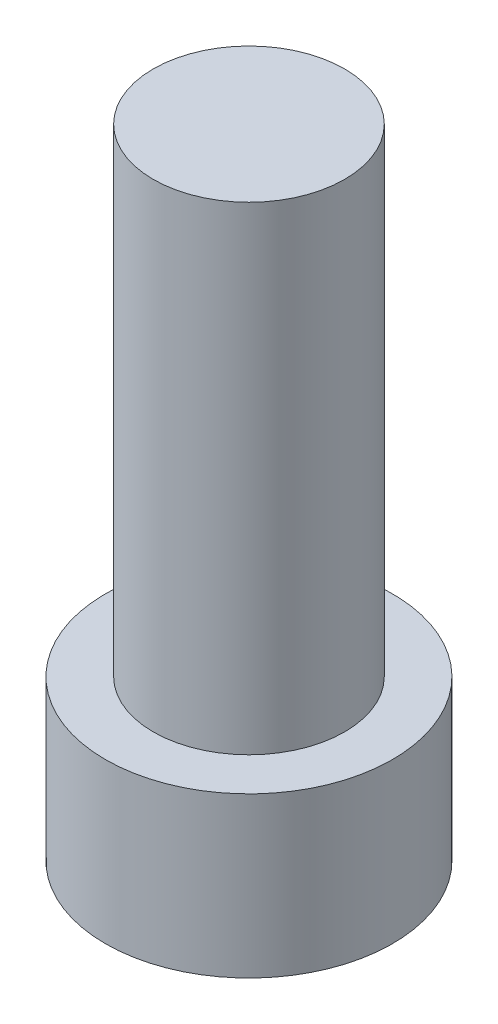
from build123d import *

# Parameters (mm, degrees)
SKETCH_1_R          = 4.5
EXTRUDE_1_DEPTH     = 20
CUT_EXTRUDE_START   = -15
SKETCH_2_R          = 4.5
SKETCH_2_R_2        = 3
CUT_EXTRUDE_1_DEPTH = 15
SKETCH_3_R          = 1.5875
CUT_EXTRUDE_2_DEPTH = 15


with BuildPart() as part:
    # Эскиз1 → Бобышка-Вытянуть1 (new body)
    with BuildSketch(Plane(origin=(0, 0, 0), x_dir=(1, 0, 0), z_dir=(0, 1, 0))):
        with Locations(Location((0, 0, 0), (0, 0, 270))):
            Circle(SKETCH_1_R)
    extrude(amount=EXTRUDE_1_DEPTH)

    # Эскиз2 → Вырез-Вытянуть1 (cut)
    with BuildSketch(Plane(origin=(0, 20, 0), x_dir=(1, 0, 0), z_dir=(0, 1, 0)).offset(CUT_EXTRUDE_START)):
        with Locations(Location((0, 0, 0), (0, 0, 270))):
            Circle(SKETCH_2_R)
        with Locations(Location((0, 0, 0), (0, 0, 270))):
            Circle(SKETCH_2_R_2, mode=Mode.SUBTRACT)
    extrude(amount=CUT_EXTRUDE_1_DEPTH, mode=Mode.SUBTRACT)

    # Эскиз3 → Вырез-Вытянуть2 (cut)
    with BuildSketch(Plane.XZ):
        with Locations(Location((0, 0, 0), (0, 0, 270))):
            Circle(SKETCH_3_R)
    extrude(amount=-CUT_EXTRUDE_2_DEPTH, mode=Mode.SUBTRACT)


solid = part.part
